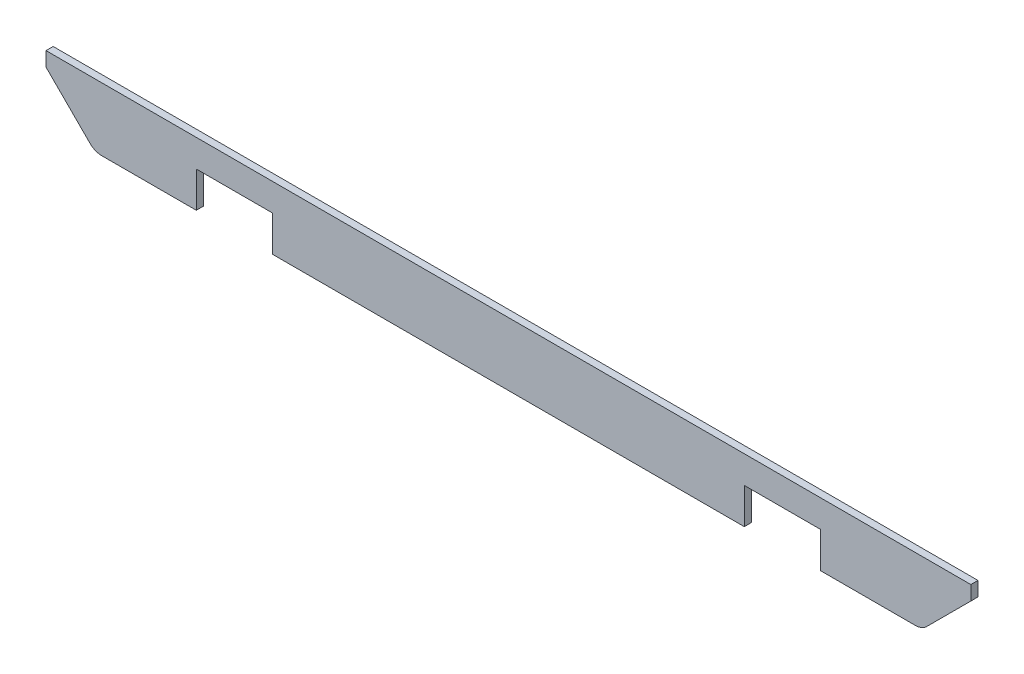
from build123d import *

# Parameters (mm, degrees)
BOSS_EXTRUDE1_DEPTH = 3


with BuildPart() as part:
    # Sketch1 → Boss-Extrude1 (new body)
    with BuildSketch(Plane.XY):
        with BuildLine():
            Line((130.955345629, -26.5), (170.433838397, -26.5))
            ThreePointArc((170.433838397, -26.5), (173.093720589, -26.044378238), (175.383585865, -24.616414135))
            Line((175.383585865, -24.616414135), (194, -6))
            Line((194, -6), (194, 0))
            Line((194, 0), (-194, 0))
            Line((-194, 0), (-194, -6))
            Line((-194, -6), (-175.383585865, -24.616414135))
            ThreePointArc((-175.383585865, -24.616414135), (-173.093720589, -26.044378238), (-170.433838397, -26.5))
            Line((-170.433838397, -26.5), (-130.955345629, -26.5))
            Line((-130.955345629, -26.5), (-130.955345629, -11.5))
            Line((-130.955345629, -11.5), (-98.955345629, -11.5))
            Line((-98.955345629, -11.5), (-98.955345629, -26.5))
            Line((-98.955345629, -26.5), (98.955345629, -26.5))
            Line((98.955345629, -26.5), (98.955345629, -11.5))
            Line((98.955345629, -11.5), (130.955345629, -11.5))
            Line((130.955345629, -11.5), (130.955345629, -26.5))
        make_face()
    extrude(amount=BOSS_EXTRUDE1_DEPTH)


solid = part.part
